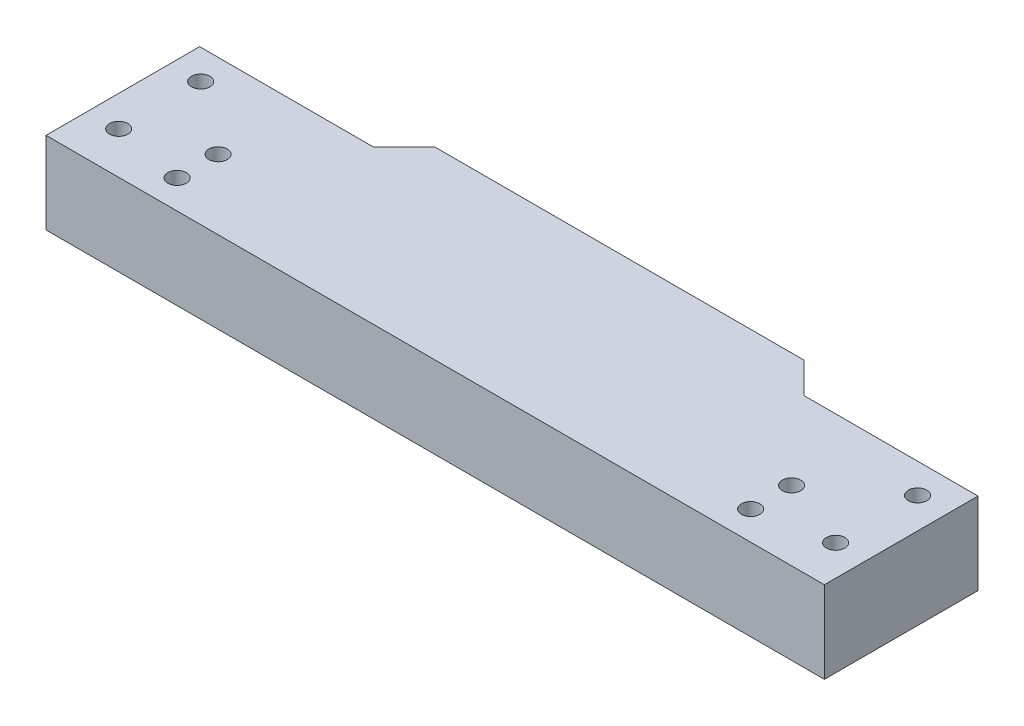
from build123d import *

# Parameters (mm, degrees)
ESQUISSE1_R        = 4.5
BOSS_EXTRU_1_DEPTH = 40


with BuildPart() as part:
    # Esquisse1 → Boss.-Extru.1 (new body)
    # profile 1 of 2: a face of its own
    with BuildSketch(Plane(origin=(0, 0, 0), x_dir=(1, 0, 0), z_dir=(0, 1, 0))):
        Polygon((-190, 75), (-190, 0), (0, 0), (0, 90), (-90, 90), (-105, 75), align=None)
        with Locations(Location((-175, 20.5, 0), (0, 0, 270))):
            Circle(ESQUISSE1_R, mode=Mode.SUBTRACT)
        with Locations(Location((-140, 14, 0), (0, 0, 270))):
            Circle(ESQUISSE1_R, mode=Mode.SUBTRACT)
        with Locations(Location((-140, 34, 0), (0, 0, 270))):
            Circle(ESQUISSE1_R, mode=Mode.SUBTRACT)
        with Locations(Location((-175, 60.5, 0), (0, 0, 270))):
            Circle(ESQUISSE1_R, mode=Mode.SUBTRACT)
    # profile 2 of 2: a face of its own
    with BuildSketch(Plane(origin=(0, 0, 0), x_dir=(1, 0, 0), z_dir=(0, 1, 0))):
        Polygon((0, 90), (0, 0), (190, 0), (190, 75), (105, 75), (90, 90), align=None)
        with Locations(Location((140, 14, 0), (0, 0, 270))):
            Circle(ESQUISSE1_R, mode=Mode.SUBTRACT)
        with Locations(Location((175, 20.5, 0), (0, 0, 270))):
            Circle(ESQUISSE1_R, mode=Mode.SUBTRACT)
        with Locations(Location((140, 34, 0), (0, 0, 270))):
            Circle(ESQUISSE1_R, mode=Mode.SUBTRACT)
        with Locations(Location((175, 60.5, 0), (0, 0, 270))):
            Circle(ESQUISSE1_R, mode=Mode.SUBTRACT)
    extrude(amount=BOSS_EXTRU_1_DEPTH)


solid = part.part
